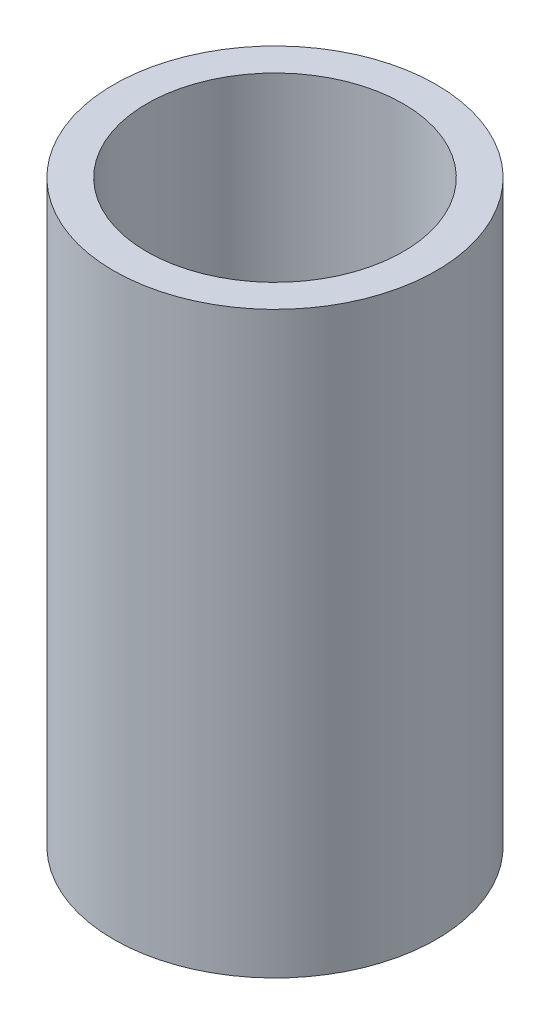
from build123d import *

# Parameters (mm, degrees)
SKETCH1_R           = 9.75
SKETCH1_R_2         = 7.75
BOSS_EXTRUDE1_DEPTH = 35


with BuildPart() as part:
    # Sketch1 → Boss-Extrude1 (new body)
    with BuildSketch(Plane(origin=(0, 0, 0), x_dir=(1, 0, 0), z_dir=(0, 1, 0))):
        with Locations(Location((0, 0, 0), (0, 0, 270))):
            Circle(SKETCH1_R)
        with Locations(Location((0, 0, 0), (0, 0, 270))):
            Circle(SKETCH1_R_2, mode=Mode.SUBTRACT)
    extrude(amount=BOSS_EXTRUDE1_DEPTH)


solid = part.part
